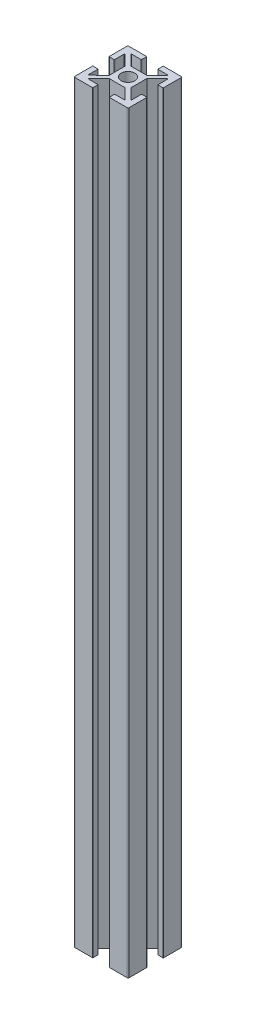
from build123d import *

# Parameters (mm, degrees)
SKETCH1_R           = 2.5
BOSS_EXTRUDE2_DEPTH = 279


with BuildPart() as part:
    # Sketch1 → Boss-Extrude2 (new body)
    with BuildSketch(Plane(origin=(0, 0, 0), x_dir=(1, 0, 0), z_dir=(0, 1, 0))):
        with BuildLine():
            Line((-9.896296296, 3), (-8.196296296, 3))
            ThreePointArc((-8.196296296, 3), (-8.090230279, 3.043933983), (-8.046296296, 3.15))
            Line((-8.046296296, 3.15), (-8.046296296, 6.586184513))
            ThreePointArc((-8.046296296, 6.586184513), (-7.954097251, 6.724600732), (-7.790842301, 6.692859041))
            Line((-7.790842301, 6.692859041), (-4, 2.945390222))
            Line((-4, 2.945390222), (-4, -2.945390222))
            Line((-4, -2.945390222), (-7.790842301, -6.692859041))
            ThreePointArc((-7.790842301, -6.692859041), (-7.954097251, -6.724600732), (-8.046296296, -6.586184513))
            Line((-8.046296296, -6.586184513), (-8.046296296, -3.15))
            ThreePointArc((-8.046296296, -3.15), (-8.090230279, -3.043933983), (-8.196296296, -3))
            Line((-8.196296296, -3), (-9.896296296, -3))
            ThreePointArc((-9.896296296, -3), (-10.002362313, -3.043933983), (-10.046296296, -3.15))
            Line((-10.046296296, -3.15), (-10.046296296, -9.65))
            ThreePointArc((-10.046296296, -9.65), (-9.94378367, -9.897487373), (-9.696296296, -10))
            Line((-9.696296296, -10), (-3.196296296, -10))
            ThreePointArc((-3.196296296, -10), (-3.090230279, -9.956066017), (-3.046296296, -9.85))
            Line((-3.046296296, -9.85), (-3.046296296, -8.15))
            ThreePointArc((-3.046296296, -8.15), (-3.090230279, -8.043933983), (-3.196296296, -8))
            Line((-3.196296296, -8), (-6.614381093, -8))
            ThreePointArc((-6.614381093, -8), (-6.753127587, -7.9070036), (-6.719835089, -7.743325472))
            Line((-6.719835089, -7.743325472), (-2.93318409, -4))
            Line((-2.93318409, -4), (2.93318409, -4))
            Line((2.93318409, -4), (6.719835089, -7.743325472))
            ThreePointArc((6.719835089, -7.743325472), (6.753127587, -7.9070036), (6.614381093, -8))
            Line((6.614381093, -8), (3.196296296, -8))
            ThreePointArc((3.196296296, -8), (3.090230279, -8.043933983), (3.046296296, -8.15))
            Line((3.046296296, -8.15), (3.046296296, -9.85))
            ThreePointArc((3.046296296, -9.85), (3.090230279, -9.956066017), (3.196296296, -10))
            Line((3.196296296, -10), (9.696296296, -10))
            ThreePointArc((9.696296296, -10), (9.94378367, -9.897487373), (10.046296296, -9.65))
            Line((10.046296296, -9.65), (10.046296296, -3.15))
            ThreePointArc((10.046296296, -3.15), (10.002362313, -3.043933983), (9.896296296, -3))
            Line((9.896296296, -3), (8.196296296, -3))
            ThreePointArc((8.196296296, -3), (8.090230279, -3.043933983), (8.046296296, -3.15))
            Line((8.046296296, -3.15), (8.046296296, -6.586184513))
            ThreePointArc((8.046296296, -6.586184513), (7.954097251, -6.724600732), (7.790842301, -6.692859041))
            Line((7.790842301, -6.692859041), (4, -2.945390222))
            Line((4, -2.945390222), (4, 2.945390222))
            Line((4, 2.945390222), (7.790842301, 6.692859041))
            ThreePointArc((7.790842301, 6.692859041), (7.954097251, 6.724600732), (8.046296296, 6.586184513))
            Line((8.046296296, 6.586184513), (8.046296296, 3.15))
            ThreePointArc((8.046296296, 3.15), (8.090230279, 3.043933983), (8.196296296, 3))
            Line((8.196296296, 3), (9.896296296, 3))
            ThreePointArc((9.896296296, 3), (10.002362313, 3.043933983), (10.046296296, 3.15))
            Line((10.046296296, 3.15), (10.046296296, 9.65))
            ThreePointArc((10.046296296, 9.65), (9.94378367, 9.897487373), (9.696296296, 10))
            Line((9.696296296, 10), (3.196296296, 10))
            ThreePointArc((3.196296296, 10), (3.090230279, 9.956066017), (3.046296296, 9.85))
            Line((3.046296296, 9.85), (3.046296296, 8.15))
            ThreePointArc((3.046296296, 8.15), (3.090230279, 8.043933983), (3.196296296, 8))
            Line((3.196296296, 8), (6.614381093, 8))
            ThreePointArc((6.614381093, 8), (6.753127587, 7.9070036), (6.719835089, 7.743325472))
            Line((6.719835089, 7.743325472), (2.93318409, 4))
            Line((2.93318409, 4), (-2.93318409, 4))
            Line((-2.93318409, 4), (-6.719835089, 7.743325472))
            ThreePointArc((-6.719835089, 7.743325472), (-6.753127587, 7.9070036), (-6.614381093, 8))
            Line((-6.614381093, 8), (-3.196296296, 8))
            ThreePointArc((-3.196296296, 8), (-3.090230279, 8.043933983), (-3.046296296, 8.15))
            Line((-3.046296296, 8.15), (-3.046296296, 9.85))
            ThreePointArc((-3.046296296, 9.85), (-3.090230279, 9.956066017), (-3.196296296, 10))
            Line((-3.196296296, 10), (-9.696296296, 10))
            ThreePointArc((-9.696296296, 10), (-9.94378367, 9.897487373), (-10.046296296, 9.65))
            Line((-10.046296296, 9.65), (-10.046296296, 3.15))
            ThreePointArc((-10.046296296, 3.15), (-10.002362313, 3.043933983), (-9.896296296, 3))
        make_face()
        with Locations(Location((0, 0, 0), (0, 0, 270))):
            Circle(SKETCH1_R, mode=Mode.SUBTRACT)
    extrude(amount=BOSS_EXTRUDE2_DEPTH)


solid = part.part
